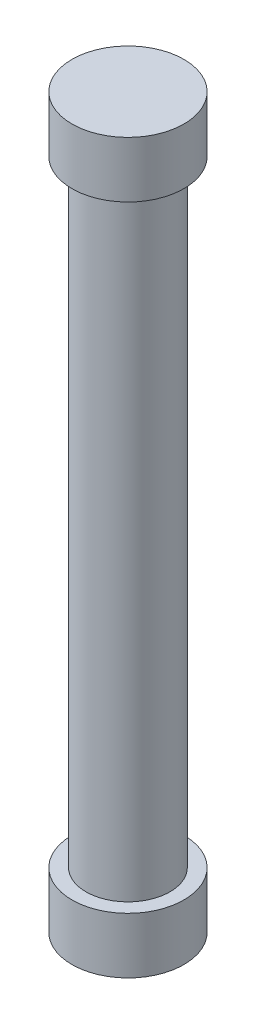
from build123d import *


with BuildPart() as part:
    # Sketch1 → Revolve1 (revolve)
    with BuildSketch(Plane.XY):
        Polygon((0, 0), (0, 2), (0.5, 2), (0.5, 24), (0, 24), (0, 26), (2, 26), (2, 0), align=None)
    revolve(axis=Axis((2, 26, 0), (0, -1, 0)))


solid = part.part
